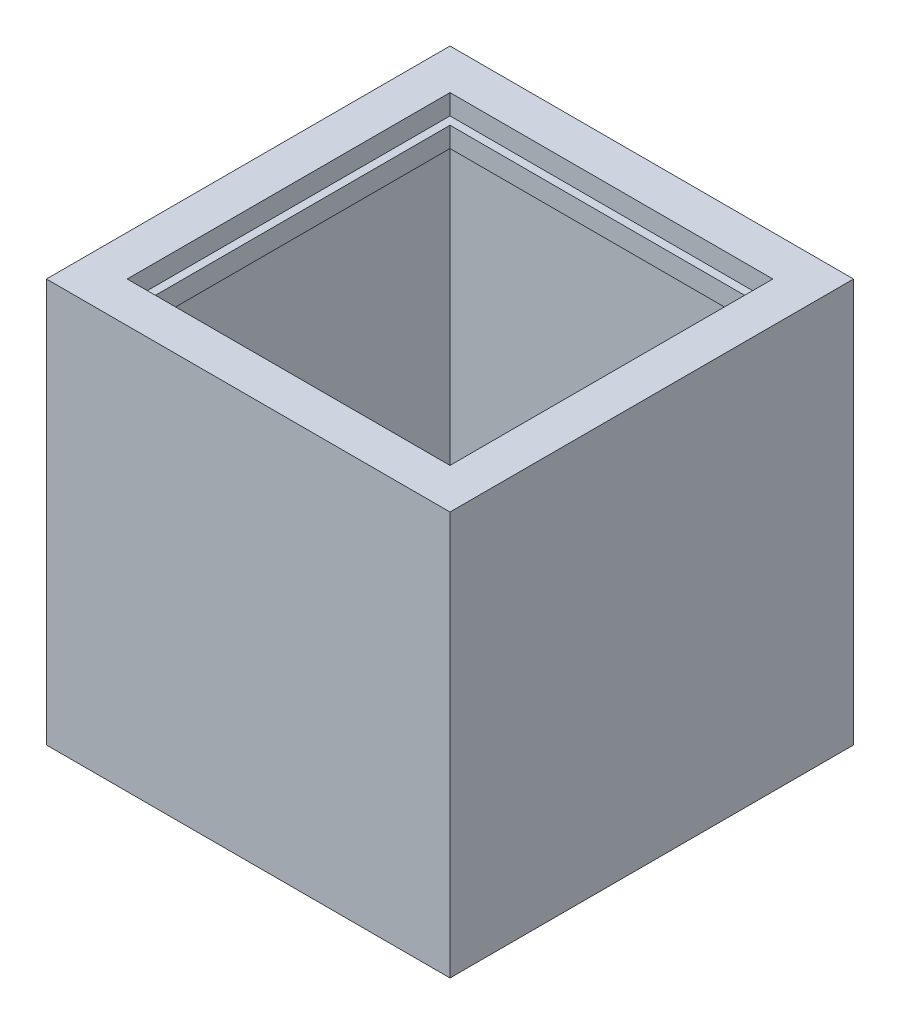
from build123d import *

# Parameters (mm, degrees)
SKETCH1_W           = 127
SKETCH1_H           = 127
BOSS_EXTRUDE1_DEPTH = 127
SKETCH2_W           = 96.52
SKETCH2_H           = 96.52
CUT_EXTRUDE1_DEPTH  = 118.11
SKETCH3_W           = 101.6
SKETCH3_H           = 101.6
SKETCH3_W_2         = 96.52
SKETCH3_H_2         = 96.52
CUT_EXTRUDE2_DEPTH  = 6.35
SKETCH5_W           = 96.52
SKETCH5_H           = 105.41
CUT_EXTRUDE3_DEPTH  = 6.35
SKETCH6_W           = 109.22
SKETCH6_H           = 105.41
CUT_EXTRUDE4_DEPTH  = 6.35


with BuildPart() as part:
    # Sketch1 → Boss-Extrude1 (new body)
    with BuildSketch(Plane.XY):
        Rectangle(SKETCH1_W, SKETCH1_H)
    extrude(amount=BOSS_EXTRUDE1_DEPTH)

    # Sketch2 → Cut-Extrude1 (cut)
    with BuildSketch(Plane(origin=(0, 63.5, 0), x_dir=(1, 0, 0), z_dir=(0, 1, 0))):
        with Locations((0, -63.5)):
            Rectangle(SKETCH2_W, SKETCH2_H)
    extrude(amount=-CUT_EXTRUDE1_DEPTH, mode=Mode.SUBTRACT)

    # Sketch3 → Cut-Extrude2 (cut)
    with BuildSketch(Plane(origin=(0, 63.5, 0), x_dir=(1, 0, 0), z_dir=(0, 1, 0))):
        with Locations((0, -63.5)):
            Rectangle(SKETCH3_W, SKETCH3_H)
        with Locations((0, -63.5)):
            Rectangle(SKETCH3_W_2, SKETCH3_H_2, mode=Mode.SUBTRACT)
    extrude(amount=-CUT_EXTRUDE2_DEPTH, mode=Mode.SUBTRACT)

    # Sketch5 → Cut-Extrude3 (cut)
    with BuildSketch(Plane.XY.offset(15.24)):
        with Locations((0, -1.905)):
            Rectangle(SKETCH5_W, SKETCH5_H)
    cut_extrude3 = extrude(amount=-CUT_EXTRUDE3_DEPTH, mode=Mode.SUBTRACT)

    # Mirror1: Cut-Extrude3 across plane
    add(cut_extrude3.mirror(Plane(origin=(0, 0, 63.5), x_dir=(1, 0, 0), z_dir=(0, 0, -1))), mode=Mode.SUBTRACT)

    # Sketch6 → Cut-Extrude4 (cut)
    with BuildSketch(Plane.ZY.offset(-48.26)):
        with Locations((63.5, -1.905)):
            Rectangle(SKETCH6_W, SKETCH6_H)
    cut_extrude4 = extrude(amount=-CUT_EXTRUDE4_DEPTH, mode=Mode.SUBTRACT)

    # Mirror2: Cut-Extrude4 across plane
    add(cut_extrude4.mirror(Plane(origin=(0, 0, 0), x_dir=(0, 0, 1), z_dir=(1, 0, 0))), mode=Mode.SUBTRACT)


solid = part.part
